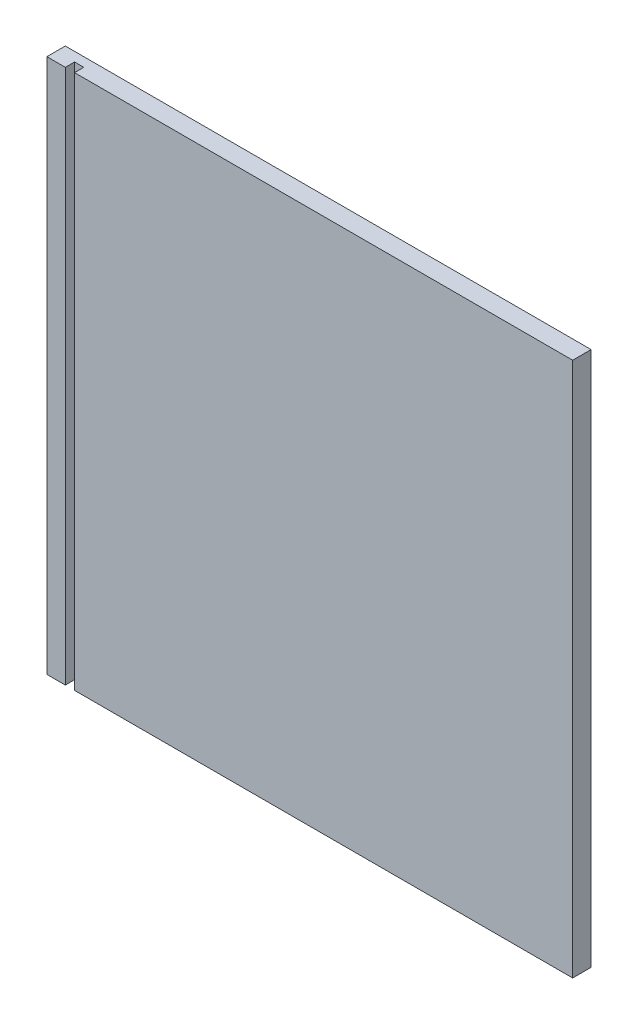
from build123d import *

# Parameters (mm, degrees)
ESQUISSE1_W             = 285
ESQUISSE1_H             = 290
BOSS_EXTRU_1_DEPTH      = 10
ESQUISSE2_W             = 5
ESQUISSE2_H             = 290
ENL_V_MAT_EXTRU_1_DEPTH = 5


with BuildPart() as part:
    # Esquisse1 → Boss.-Extru.1 (new body)
    with BuildSketch(Plane.XY):
        with Locations((-142.5, 145)):
            Rectangle(ESQUISSE1_W, ESQUISSE1_H)
    extrude(amount=BOSS_EXTRU_1_DEPTH)

    # Esquisse2 → Enlèv. mat.-Extru.1 (cut)
    with BuildSketch(Plane.XY.offset(10)):
        with Locations((-272.5, 145)):
            Rectangle(ESQUISSE2_W, ESQUISSE2_H)
    extrude(amount=-ENL_V_MAT_EXTRU_1_DEPTH, mode=Mode.SUBTRACT)


solid = part.part
